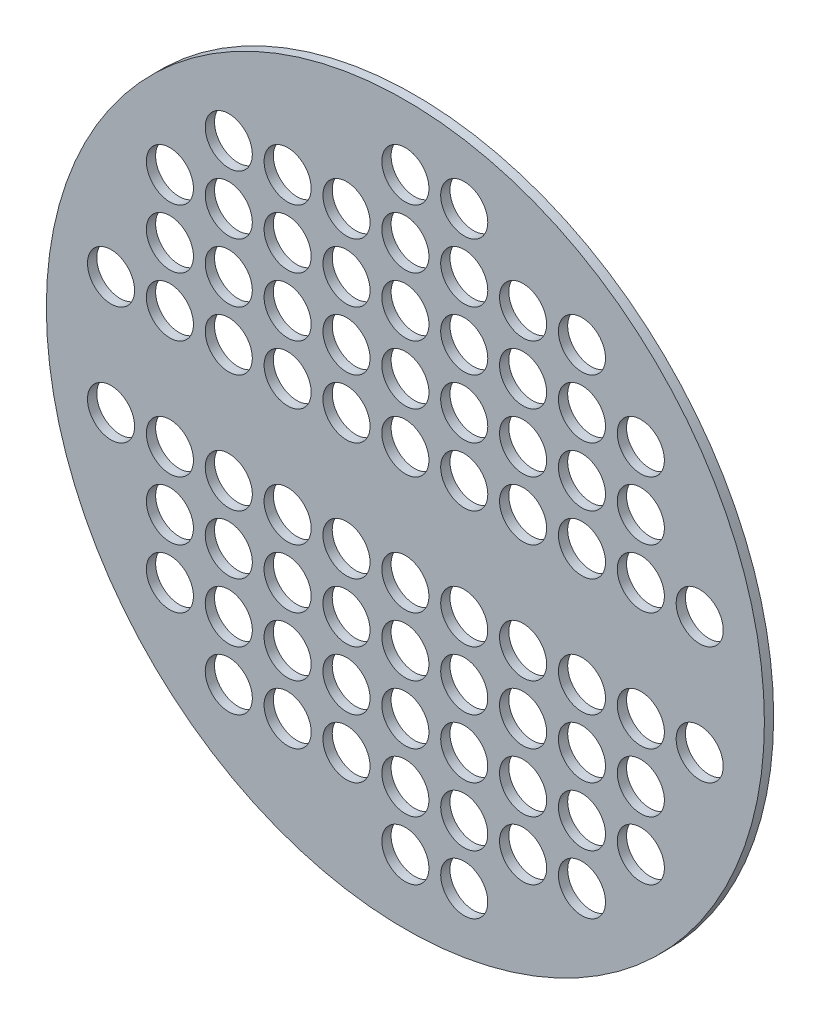
from build123d import *

# Parameters (mm, degrees)
SKETCH1_R           = 193.65
BOSS_EXTRUDE1_DEPTH = 5
SKETCH2_R           = 12.7
CUT_EXTRUDE1_DEPTH  = 274.908095901


with BuildPart() as part:
    # Sketch1 → Boss-Extrude1 (new body)
    with BuildSketch(Plane.XY):
        Circle(SKETCH1_R)
    extrude(amount=BOSS_EXTRUDE1_DEPTH)

    # Sketch2 → Cut-Extrude1 (cut, through all)
    with BuildSketch(Plane.XY.offset(5)):
        with Locations((0, 158.75)):
            Circle(SKETCH2_R)
        with Locations((31.75, 158.75)):
            Circle(SKETCH2_R)
        with Locations((-95.25, 127)):
            Circle(SKETCH2_R)
        with Locations((-63.5, 127)):
            Circle(SKETCH2_R)
        with Locations((-31.75, 127)):
            Circle(SKETCH2_R)
        with Locations((0, 127)):
            Circle(SKETCH2_R)
        with Locations((31.75, 127)):
            Circle(SKETCH2_R)
        with Locations((63.5, 127)):
            Circle(SKETCH2_R)
        with Locations((95.25, 127)):
            Circle(SKETCH2_R)
        with Locations((-63.5, 95.25)):
            Circle(SKETCH2_R)
        with Locations((-31.75, 95.25)):
            Circle(SKETCH2_R)
        with Locations((0, 95.25)):
            Circle(SKETCH2_R)
        with Locations((31.75, 95.25)):
            Circle(SKETCH2_R)
        with Locations((63.5, 95.25)):
            Circle(SKETCH2_R)
        with Locations((95.25, 95.25)):
            Circle(SKETCH2_R)
        with Locations((-63.5, 63.5)):
            Circle(SKETCH2_R)
        with Locations((-31.75, 63.5)):
            Circle(SKETCH2_R)
        with Locations((0, 63.5)):
            Circle(SKETCH2_R)
        with Locations((31.75, 63.5)):
            Circle(SKETCH2_R)
        with Locations((63.5, 63.5)):
            Circle(SKETCH2_R)
        with Locations((95.25, 63.5)):
            Circle(SKETCH2_R)
        with Locations((-63.5, 31.75)):
            Circle(SKETCH2_R)
        with Locations((-31.75, 31.75)):
            Circle(SKETCH2_R)
        with Locations((0, 31.75)):
            Circle(SKETCH2_R)
        with Locations((31.75, 31.75)):
            Circle(SKETCH2_R)
        with Locations((63.5, 31.75)):
            Circle(SKETCH2_R)
        with Locations((95.25, 31.75)):
            Circle(SKETCH2_R)
        with Locations((-95.25, 95.25)):
            Circle(SKETCH2_R)
        with Locations((-95.25, 63.5)):
            Circle(SKETCH2_R)
        with Locations((-95.25, 31.75)):
            Circle(SKETCH2_R)
        with Locations((-127, 95.25)):
            Circle(SKETCH2_R)
        with Locations((-127, 63.5)):
            Circle(SKETCH2_R)
        with Locations((-127, 31.75)):
            Circle(SKETCH2_R)
        with Locations((-158.75, 31.75)):
            Circle(SKETCH2_R)
        with Locations(Location((158.75, 31.75, 0), (0, 0, 180))):
            Circle(SKETCH2_R)
        with Locations(Location((127, 31.75, 0), (0, 0, 180))):
            Circle(SKETCH2_R)
        with Locations(Location((127, 63.5, 0), (0, 0, 180))):
            Circle(SKETCH2_R)
        with Locations(Location((127, 95.25, 0), (0, 0, 180))):
            Circle(SKETCH2_R)
        with Locations((127, -95.25)):
            Circle(SKETCH2_R)
        with Locations((127, -63.5)):
            Circle(SKETCH2_R)
        with Locations((127, -31.75)):
            Circle(SKETCH2_R)
        with Locations((158.75, -31.75)):
            Circle(SKETCH2_R)
        with Locations(Location((-158.75, -31.75, 0), (0, 0, 180))):
            Circle(SKETCH2_R)
        with Locations(Location((-127, -31.75, 0), (0, 0, 180))):
            Circle(SKETCH2_R)
        with Locations(Location((-127, -63.5, 0), (0, 0, 180))):
            Circle(SKETCH2_R)
        with Locations(Location((-127, -95.25, 0), (0, 0, 180))):
            Circle(SKETCH2_R)
        with Locations(Location((-95.25, -31.75, 0), (0, 0, 180))):
            Circle(SKETCH2_R)
        with Locations(Location((-95.25, -63.5, 0), (0, 0, 180))):
            Circle(SKETCH2_R)
        with Locations(Location((-95.25, -95.25, 0), (0, 0, 180))):
            Circle(SKETCH2_R)
        with Locations(Location((95.25, -31.75, 0), (0, 0, 180))):
            Circle(SKETCH2_R)
        with Locations(Location((63.5, -31.75, 0), (0, 0, 180))):
            Circle(SKETCH2_R)
        with Locations(Location((31.75, -31.75, 0), (0, 0, 180))):
            Circle(SKETCH2_R)
        with Locations(Location((0, -31.75, 0), (0, 0, 180))):
            Circle(SKETCH2_R)
        with Locations(Location((-31.75, -31.75, 0), (0, 0, 180))):
            Circle(SKETCH2_R)
        with Locations(Location((-63.5, -31.75, 0), (0, 0, 180))):
            Circle(SKETCH2_R)
        with Locations(Location((95.25, -63.5, 0), (0, 0, 180))):
            Circle(SKETCH2_R)
        with Locations(Location((63.5, -63.5, 0), (0, 0, 180))):
            Circle(SKETCH2_R)
        with Locations(Location((31.75, -63.5, 0), (0, 0, 180))):
            Circle(SKETCH2_R)
        with Locations(Location((0, -63.5, 0), (0, 0, 180))):
            Circle(SKETCH2_R)
        with Locations(Location((-31.75, -63.5, 0), (0, 0, 180))):
            Circle(SKETCH2_R)
        with Locations(Location((-63.5, -63.5, 0), (0, 0, 180))):
            Circle(SKETCH2_R)
        with Locations(Location((95.25, -95.25, 0), (0, 0, 180))):
            Circle(SKETCH2_R)
        with Locations(Location((63.5, -95.25, 0), (0, 0, 180))):
            Circle(SKETCH2_R)
        with Locations(Location((31.75, -95.25, 0), (0, 0, 180))):
            Circle(SKETCH2_R)
        with Locations(Location((0, -95.25, 0), (0, 0, 180))):
            Circle(SKETCH2_R)
        with Locations(Location((-31.75, -95.25, 0), (0, 0, 180))):
            Circle(SKETCH2_R)
        with Locations(Location((-63.5, -95.25, 0), (0, 0, 180))):
            Circle(SKETCH2_R)
        with Locations(Location((95.25, -127, 0), (0, 0, 180))):
            Circle(SKETCH2_R)
        with Locations(Location((63.5, -127, 0), (0, 0, 180))):
            Circle(SKETCH2_R)
        with Locations(Location((31.75, -127, 0), (0, 0, 180))):
            Circle(SKETCH2_R)
        with Locations(Location((0, -127, 0), (0, 0, 180))):
            Circle(SKETCH2_R)
        with Locations(Location((-31.75, -127, 0), (0, 0, 180))):
            Circle(SKETCH2_R)
        with Locations(Location((-63.5, -127, 0), (0, 0, 180))):
            Circle(SKETCH2_R)
        with Locations(Location((-95.25, -127, 0), (0, 0, 180))):
            Circle(SKETCH2_R)
        with Locations(Location((31.75, -158.75, 0), (0, 0, 180))):
            Circle(SKETCH2_R)
        with Locations(Location((0, -158.75, 0), (0, 0, 180))):
            Circle(SKETCH2_R)
    extrude(amount=-CUT_EXTRUDE1_DEPTH, mode=Mode.SUBTRACT)


solid = part.part
